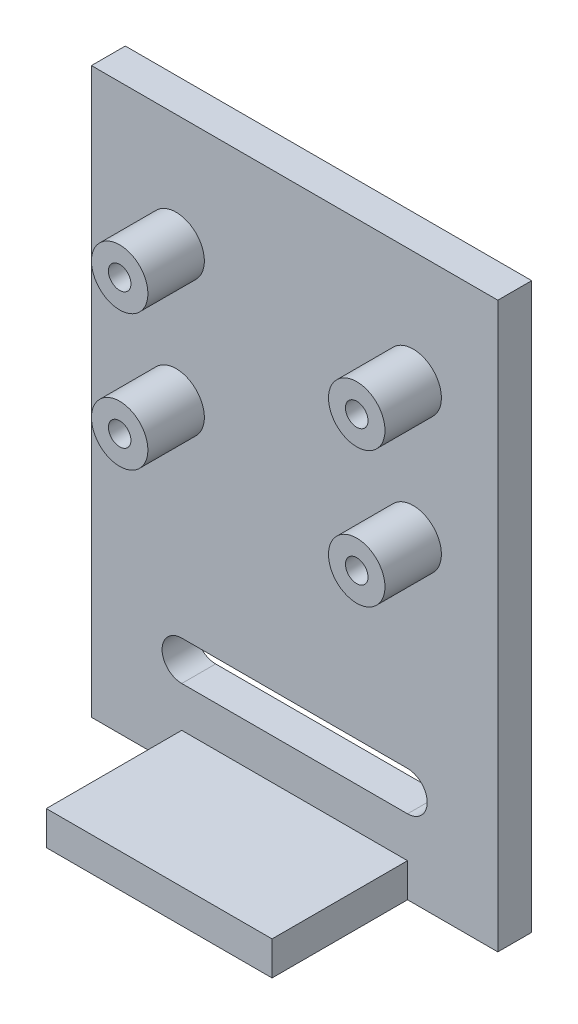
from build123d import *

# Parameters (mm, degrees)
SKETCH1_W           = 36
SKETCH1_H           = 50
BOSS_EXTRUDE1_DEPTH = 3
SKETCH2_W           = 20
SKETCH2_H           = 3
BOSS_EXTRUDE2_DEPTH = 12
CUT_EXTRUDE1_DEPTH  = 5
SKETCH5_R           = 2.5
SKETCH5_R_2         = 1
BOSS_EXTRUDE4_DEPTH = 5


with BuildPart() as part:
    # Sketch1 → Boss-Extrude1 (new body)
    with BuildSketch(Plane.XY):
        with Locations((-6.367052023, -5.057803468)):
            Rectangle(SKETCH1_W, SKETCH1_H)
    extrude(amount=BOSS_EXTRUDE1_DEPTH)

    # Sketch2 → Boss-Extrude2 (add)
    with BuildSketch(Plane.XY.offset(3)):
        with Locations((-6.367052023, -28.557803468)):
            Rectangle(SKETCH2_W, SKETCH2_H)
    extrude(amount=BOSS_EXTRUDE2_DEPTH)

    # Sketch4 → Cut-Extrude1 (cut)
    with BuildSketch(Plane.XY.offset(3)):
        with BuildLine():
            Line((-16.367052023, -19.980355704), (3.632947977, -19.980355704))
            ThreePointArc((3.632947977, -19.980355704), (5.373912404, -21.721320132), (3.632947977, -23.462284559))
            Line((3.632947977, -23.462284559), (-16.367052023, -23.462284559))
            ThreePointArc((-16.367052023, -23.462284559), (-18.108016451, -21.721320132), (-16.367052023, -19.980355704))
        make_face()
    extrude(amount=-CUT_EXTRUDE1_DEPTH, mode=Mode.SUBTRACT)

    # Sketch5 → Boss-Extrude4 (add)
    # profile 1 of 4: a face of its own
    with BuildSketch(Plane.XY.offset(3)):
        with Locations(Location((4.132947977, 9.942196532, 0), (0, 0, 180))):
            Circle(SKETCH5_R)
        with Locations((4.132947977, 9.942196532)):
            Circle(SKETCH5_R_2, mode=Mode.SUBTRACT)
    # profile 2 of 4: a face of its own
    with BuildSketch(Plane.XY.offset(3)):
        with Locations(Location((-16.867052023, 9.942196532, 0), (0, 0, 180))):
            Circle(SKETCH5_R)
        with Locations((-16.867052023, 9.942196532)):
            Circle(SKETCH5_R_2, mode=Mode.SUBTRACT)
    # profile 3 of 4: a face of its own
    with BuildSketch(Plane.XY.offset(3)):
        with Locations(Location((-16.867052023, -2.057803468, 0), (0, 0, 180))):
            Circle(SKETCH5_R)
        with Locations((-16.867052023, -2.057803468)):
            Circle(SKETCH5_R_2, mode=Mode.SUBTRACT)
    # profile 4 of 4: a face of its own
    with BuildSketch(Plane.XY.offset(3)):
        with Locations(Location((4.132947977, -2.057803468, 0), (0, 0, 180))):
            Circle(SKETCH5_R)
        with Locations((4.132947977, -2.057803468)):
            Circle(SKETCH5_R_2, mode=Mode.SUBTRACT)
    extrude(amount=BOSS_EXTRUDE4_DEPTH)


solid = part.part
